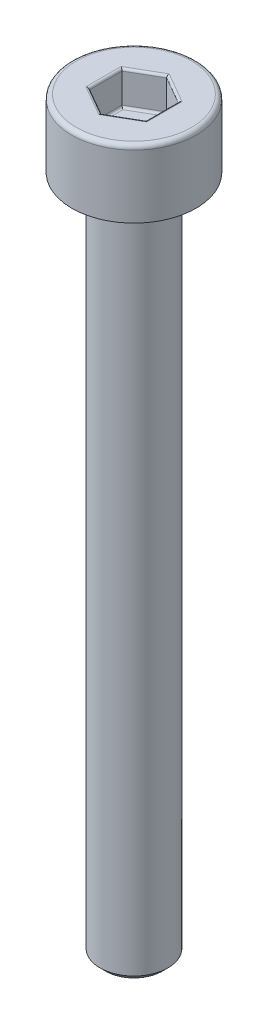
from build123d import *

# Parameters (mm, degrees)
CHAMFER1_SIZE      = 0.25
FILLET1_R          = 0.2
CUT_EXTRUDE1_DEPTH = 1.5
FILLET2_R          = 0.1


with BuildPart() as part:
    # Sketch1 → Revolve1 (revolve)
    with BuildSketch(Plane.XY, mode=Mode.PRIVATE) as revolve1_sk:
        Polygon((0, -33), (-1.5, -33), (-1.5, -3), (-2.75, -3), (-2.75, 0), (0, 0), align=None)
    revolve(revolve1_sk.sketch.rotate(Axis((0, 0, 0), (0, -1, 0)), 270), axis=Axis((0, 0, 0), (0, -1, 0)))

    # Chamfer1
    chamfer1_edges = [part.edges().sort_by_distance(p)[0] for p in [
        (0, -3, -1.5),
        (0, -33, -1.5),
    ]]
    chamfer(chamfer1_edges, length=CHAMFER1_SIZE)

    # Fillet1
    fillet1_edges = [part.edges().sort_by_distance(p)[0] for p in [
        (0, 0, -2.75),
    ]]
    fillet(fillet1_edges, radius=FILLET1_R)

    # Sketch2 → Cut-Extrude1 (cut)
    with BuildSketch(Plane(origin=(0, 0, 0), x_dir=(1, 0, 0), z_dir=(0, 1, 0))):
        Polygon((0, 1.443375673), (-1.25, 0.721687836), (-1.25, -0.721687836), (0, -1.443375673), (1.25, -0.721687836), (1.25, 0.721687836), align=None)
    extrude(amount=-CUT_EXTRUDE1_DEPTH, mode=Mode.SUBTRACT)

    # Fillet2
    fillet2_edges = [part.edges().sort_by_distance(p)[0] for p in [
        (0.625, -1.5, -1.082531755),
        (1.25, -1.5, 0),
        (0.625, -1.5, 1.082531755),
        (-0.625, -1.5, 1.082531755),
        (-1.25, -1.5, 0),
        (-0.625, -1.5, -1.082531755),
        (0.625, 0, -1.082531755),
        (-0.625, 0, -1.082531755),
        (-1.25, 0, 0),
        (-0.625, 0, 1.082531755),
        (0.625, 0, 1.082531755),
        (1.25, 0, 0),
    ]]
    fillet(fillet2_edges, radius=FILLET2_R)


solid = part.part
